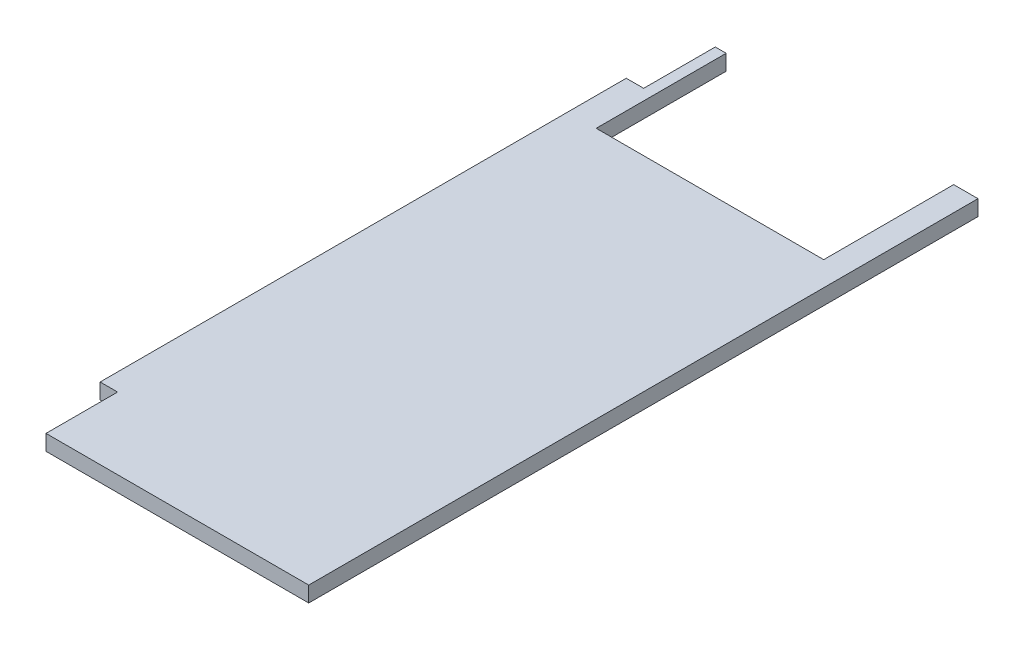
from build123d import *

# Parameters (mm, degrees)
ESQUISSE1_W             = 180
ESQUISSE1_H             = 430
BOSS_EXTRU_1_DEPTH      = 10
ESQUISSE2_W             = 146.172243306
ESQUISSE2_H             = 83.5
ENL_V_MAT_EXTRU_1_DEPTH = 10
ESQUISSE3_W             = 11.2
ESQUISSE3_H             = 46
ENL_V_MAT_EXTRU_2_DEPTH = 10


with BuildPart() as part:
    # Esquisse1 → Boss.-Extru.1 (new body)
    with BuildSketch(Plane(origin=(0, 0, 0), x_dir=(1, 0, 0), z_dir=(0, 1, 0))):
        with Locations((-90, 215)):
            Rectangle(ESQUISSE1_W, ESQUISSE1_H)
    extrude(amount=BOSS_EXTRU_1_DEPTH)

    # Esquisse2 → Enlèv. mat.-Extru.1 (cut)
    with BuildSketch(Plane(origin=(0, 10, 0), x_dir=(1, 0, 0), z_dir=(0, 1, 0))):
        with Locations((-88.713878322, 388.25)):
            Rectangle(ESQUISSE2_W, ESQUISSE2_H)
    extrude(amount=-ENL_V_MAT_EXTRU_1_DEPTH, mode=Mode.SUBTRACT)

    # Esquisse3 → Enlèv. mat.-Extru.2 (cut)
    with BuildSketch(Plane(origin=(0, 10, 0), x_dir=(1, 0, 0), z_dir=(0, 1, 0))):
        with Locations((-174.4, 407)):
            Rectangle(ESQUISSE3_W, ESQUISSE3_H)
        with Locations((-174.4, 23)):
            Rectangle(ESQUISSE3_W, ESQUISSE3_H)
    extrude(amount=-ENL_V_MAT_EXTRU_2_DEPTH, mode=Mode.SUBTRACT)


solid = part.part
